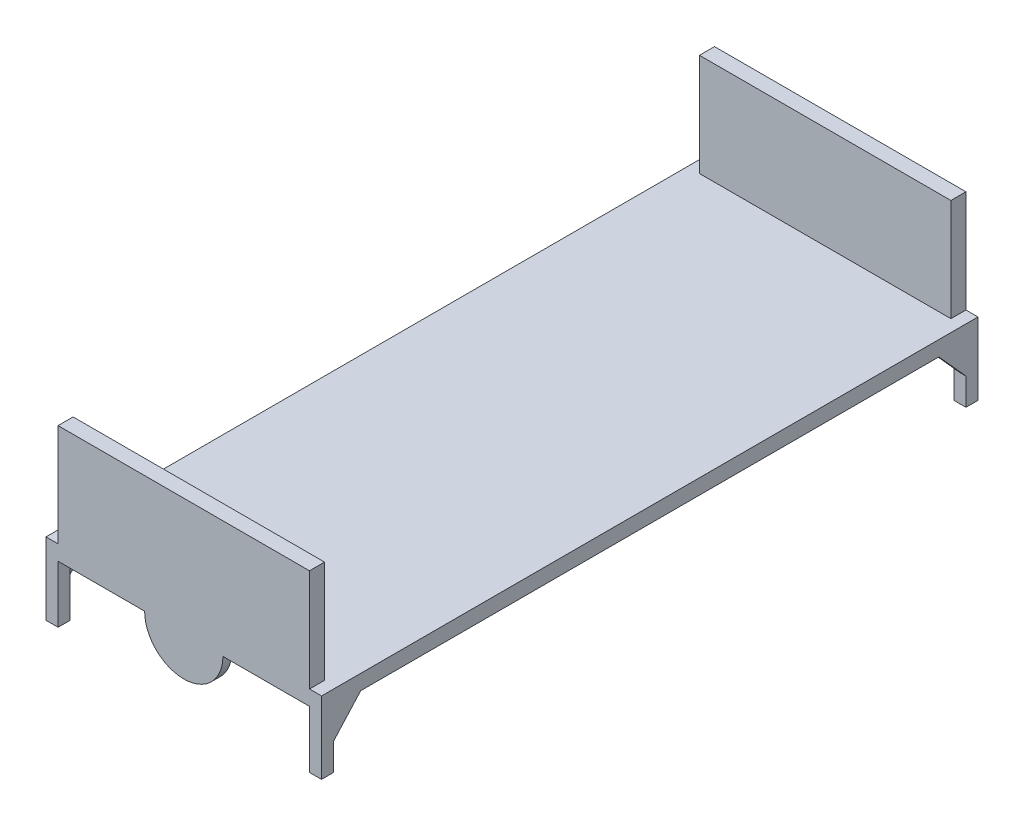
from build123d import *

# Parameters (mm, degrees)
BOSS_EXTRUDE1_DEPTH      = 50
BOSS_EXTRUDE2_DEPTH      = 340
BOSS_EXTRUDE2_DEPTH_BACK = 50
SKETCH1_3_W              = 835
SKETCH1_3_H              = 50
SKETCH1_4_W              = 40
SKETCH1_4_H              = 40
BOSS_EXTRUDE3_DEPTH      = 240
BOSS_EXTRUDE4_DEPTH      = 20
BOSS_EXTRUDE5_DEPTH      = 20
SKETCH5_W                = 30
SKETCH5_H                = 30
CUT_EXTRUDE1_DEPTH       = 200
BOSS_EXTRUDE6_DEPTH      = 30
BOSS_EXTRUDE7_START      = -30
BOSS_EXTRUDE7_DEPTH      = 30
BOSS_EXTRUDE8_DEPTH      = 20
BOSS_EXTRUDE8_DEPTH_BACK = 20


with BuildPart() as part:
    # Sketch1 → Boss-Extrude1 (new body)
    with BuildSketch(Plane(origin=(0, 0, 0), x_dir=(1, 0, 0), z_dir=(0, 1, 0))):
        Polygon((-457.5, 40), (-417.5, 40), (-417.5, 50), (417.5, 50), (417.5, 40), (457.5, 40), (457.5, 2140), (417.5, 2140), (417.5, 2130), (-417.5, 2130), (-417.5, 2140), (-457.5, 2140), align=None)
    extrude(amount=-BOSS_EXTRUDE1_DEPTH)

    # Sketch1<3> → Boss-Extrude2 (add, two sides: drawn at the far end of the back side and taken through both)
    with BuildSketch(Plane(origin=(0, 0, 0), x_dir=(1, 0, 0), z_dir=(0, 1, 0)).offset(-BOSS_EXTRUDE2_DEPTH_BACK)):
        with Locations((0, 25)):
            Rectangle(SKETCH1_3_W, SKETCH1_3_H)
        with Locations((0, 2155)):
            Rectangle(SKETCH1_3_W, SKETCH1_3_H)
    extrude(amount=BOSS_EXTRUDE2_DEPTH + BOSS_EXTRUDE2_DEPTH_BACK)

    # Sketch1<4> → Boss-Extrude3 (add)
    with BuildSketch(Plane(origin=(0, 0, 0), x_dir=(1, 0, 0), z_dir=(0, 1, 0))):
        with Locations((-437.5, 20)):
            Rectangle(SKETCH1_4_W, SKETCH1_4_H)
        with Locations((437.5, 20)):
            Rectangle(SKETCH1_4_W, SKETCH1_4_H)
        with Locations((-437.5, 2160)):
            Rectangle(SKETCH1_4_W, SKETCH1_4_H)
        with Locations((437.5, 2160)):
            Rectangle(SKETCH1_4_W, SKETCH1_4_H)
    extrude(amount=-BOSS_EXTRUDE3_DEPTH)

    # Sketch3 → Boss-Extrude4 (add)
    with BuildSketch(Plane(origin=(457.5, 0, 0), x_dir=(0, 0, -1), z_dir=(1, 0, 0))):
        Polygon((40, -50), (40, -150), (130, -50), align=None)
        Polygon((2140, -50), (2050, -50), (2140, -150), align=None)
    extrude(amount=-BOSS_EXTRUDE4_DEPTH)

    # Sketch4 → Boss-Extrude5 (add)
    with BuildSketch(Plane(origin=(-457.5, 0, -45.75), x_dir=(0, 0, -1), z_dir=(1, 0, 0))):
        Polygon((-5.75, -50), (-5.75, -150), (84.25, -50), align=None)
        Polygon((2094.25, -50), (2004.25, -50), (2094.25, -150), align=None)
    extrude(amount=BOSS_EXTRUDE5_DEPTH)

    # Sketch5 → Cut-Extrude1 (cut)
    with BuildSketch(Plane.XZ.offset(240)):
        with Locations((-437.5, -2160)):
            Rectangle(SKETCH5_W, SKETCH5_H)
        with Locations((437.5, -2160)):
            Rectangle(SKETCH5_W, SKETCH5_H)
        with Locations((437.5, -20)):
            Rectangle(SKETCH5_W, SKETCH5_H)
        with Locations((-437.5, -20)):
            Rectangle(SKETCH5_W, SKETCH5_H)
    extrude(amount=-CUT_EXTRUDE1_DEPTH, mode=Mode.SUBTRACT)

    # Sketch6 → Boss-Extrude6 (add)
    with BuildSketch(Plane.XY):
        with BuildLine():
            Line((130, -50), (-130, -50))
            ThreePointArc((-130, -50), (0, -180), (130, -50))
        make_face()
    extrude(amount=-BOSS_EXTRUDE6_DEPTH)

    # Sketch7 → Boss-Extrude7 (add)
    with BuildSketch(Plane(origin=(0, 0, -2180), x_dir=(-1, 0, 0), z_dir=(0, 0, -1)).offset(BOSS_EXTRUDE7_START)):
        with BuildLine():
            Line((130, -50), (-130, -50))
            ThreePointArc((-130, -50), (0, -180), (130, -50))
        make_face()
    extrude(amount=BOSS_EXTRUDE7_DEPTH)

    # 3DSketch1 → Boss-Extrude8 (add, two sides: drawn at the far end of the back side and taken through both)
    with BuildSketch(Plane(origin=(0, -180, -30), x_dir=(0, 0.018864566947613626, -0.9998220482235222), z_dir=(1, 0, 0)).offset(-BOSS_EXTRUDE8_DEPTH_BACK)):
        Polygon((0, 0), (0.754582678, 39.992881929), (2120.377324912, 0), (2119.622742234, -39.992881929), align=None)
    extrude(amount=BOSS_EXTRUDE8_DEPTH + BOSS_EXTRUDE8_DEPTH_BACK)


solid = part.part
